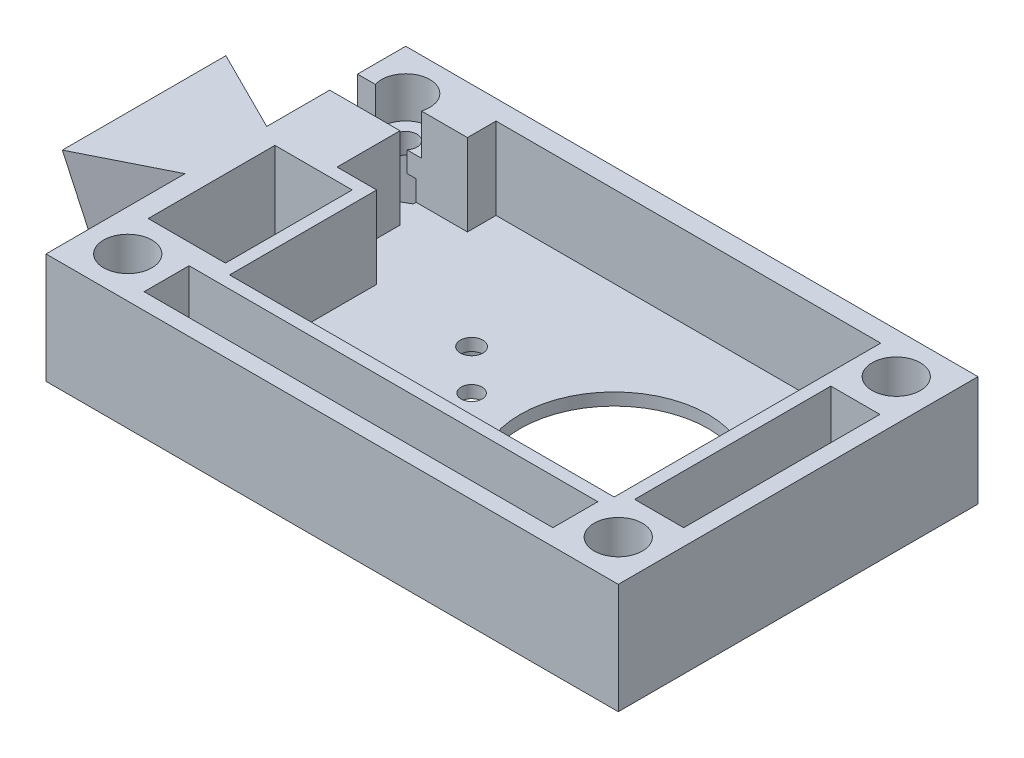
from build123d import *

# Parameters (mm, degrees)
SKETCH3_W           = 381
SKETCH3_H           = 111.76
BOSS_EXTRUDE1_DEPTH = 34.29
SKETCH2_4_R         = 29.21
CUT_EXTRUDE2_DEPTH  = 127
CUT_EXTRUDE3_START  = 8.89
SKETCH2_5_W         = 119.507
SKETCH2_5_H         = 82.804
CUT_EXTRUDE3_DEPTH  = 127
CUT_EXTRUDE4_START  = 8.89
SKETCH2_W           = 6.604
SKETCH2_H           = 8.636
CUT_EXTRUDE4_DEPTH  = 127
CUT_EXTRUDE6_DEPTH  = 127
CUT_EXTRUDE7_DEPTH  = 127
SKETCH7_W           = 19.689939458
SKETCH7_H           = 8.636
CUT_EXTRUDE8_DEPTH  = 25.4
SKETCH8_W           = 102.108
SKETCH8_H           = 102.108
CUT_EXTRUDE9_DEPTH  = 5.08
SKETCH9_R           = 7.5
CUT_EXTRUDE10_DEPTH = 12.7
SKETCH10_R          = 3.5
CUT_EXTRUDE11_DEPTH = 55.372
CUT_EXTRUDE12_DEPTH = 15.24
SKETCH12_R          = 3.25
SKETCH12_R_2        = 3.5
CUT_EXTRUDE13_DEPTH = 12.446
SKETCH13_R          = 7.5
CUT_EXTRUDE14_DEPTH = 5.08
SKETCH14_W          = 127
SKETCH14_H          = 13.97
SKETCH14_W_2        = 24.003
SKETCH14_H_2        = 39.37
SKETCH14_W_3        = 15.24
SKETCH14_H_3        = 60.96
CUT_EXTRUDE15_DEPTH = 25.4


with BuildPart() as part:
    # Sketch3 → Boss-Extrude1 (new body)
    with BuildSketch(Plane(origin=(0, 0, 0), x_dir=(1, 0, 0), z_dir=(0, 1, 0))):
        with Locations((139.7, 36.195)):
            Rectangle(SKETCH3_W, SKETCH3_H)
    extrude(amount=BOSS_EXTRUDE1_DEPTH)

    # Sketch2<4> → Cut-Extrude2 (cut)
    with BuildSketch(Plane(origin=(0, 0, 0), x_dir=(1, 0, 0), z_dir=(0, 1, 0))):
        with Locations(Location((273.05, 36.195, 0), (0, 0, 270))):
            Circle(SKETCH2_4_R)
    extrude(amount=CUT_EXTRUDE2_DEPTH, mode=Mode.SUBTRACT)

    # Sketch2<5> → Cut-Extrude3 (cut)
    with BuildSketch(Plane(origin=(0, 0, 0), x_dir=(1, 0, 0), z_dir=(0, 1, 0)).offset(CUT_EXTRUDE3_START)):
        with Locations((246.3165, 44.577)):
            Rectangle(SKETCH2_5_W, SKETCH2_5_H)
    extrude(amount=CUT_EXTRUDE3_DEPTH, mode=Mode.SUBTRACT)

    # Sketch2 → Cut-Extrude4 (cut)
    with BuildSketch(Plane(origin=(0, 0, 0), x_dir=(1, 0, 0), z_dir=(0, 1, 0)).offset(CUT_EXTRUDE4_START)):
        Polygon((174.244, 48.895), (186.563, 48.895), (186.563, 77.089), (174.244, 77.089), (174.244, 68.453), align=None)
        with Locations((170.942, 72.771)):
            Rectangle(SKETCH2_W, SKETCH2_H)
    extrude(amount=CUT_EXTRUDE4_DEPTH, mode=Mode.SUBTRACT)

    # Sketch4 → Cut-Extrude6 (cut)
    with BuildSketch(Plane(origin=(0, 34.29, 0), x_dir=(1, 0, 0), z_dir=(0, 1, 0))):
        Polygon((152.4, 48.895), (127, 61.595), (127, 10.795), (152.4, 23.495), (152.4, -19.685), (-50.8, -19.685), (-50.8, 92.075), (152.4, 92.075), align=None)
    extrude(amount=-CUT_EXTRUDE6_DEPTH, mode=Mode.SUBTRACT)

    # Sketch6 → Cut-Extrude7 (cut)
    with BuildSketch(Plane.XY.offset(19.685)):
        Polygon((127, 34.29), (136.187977808, 0), (101.054732315, 0), align=None)
    extrude(amount=-CUT_EXTRUDE7_DEPTH, mode=Mode.SUBTRACT)

    # Sketch7 → Cut-Extrude8 (cut)
    with BuildSketch(Plane(origin=(0, 34.29, 0), x_dir=(1, 0, 0), z_dir=(0, 1, 0))):
        with Locations((157.795030271, 72.771)):
            Rectangle(SKETCH7_W, SKETCH7_H)
    extrude(amount=-CUT_EXTRUDE8_DEPTH, mode=Mode.SUBTRACT)

    # Sketch8 → Cut-Extrude9 (cut)
    with BuildSketch(Plane.XZ):
        with Locations((273.05, -36.195)):
            Rectangle(SKETCH8_W, SKETCH8_H)
    extrude(amount=-CUT_EXTRUDE9_DEPTH, mode=Mode.SUBTRACT)

    # Sketch9 → Cut-Extrude10 (cut)
    with BuildSketch(Plane(origin=(0, 34.29, 0), x_dir=(1, 0, 0), z_dir=(0, 1, 0))):
        with Locations(Location((317.5, 79.375, 0), (0, 0, 270))):
            Circle(SKETCH9_R)
        with Locations(Location((317.5, -6.985, 0), (0, 0, 270))):
            Circle(SKETCH9_R)
        with Locations((165.1, 79.375)):
            Circle(SKETCH9_R)
        with Locations(Location((165.1, -6.985, 0), (0, 0, 270))):
            Circle(SKETCH9_R)
    extrude(amount=-CUT_EXTRUDE10_DEPTH, mode=Mode.SUBTRACT)

    # Sketch10 → Cut-Extrude11 (cut)
    with BuildSketch(Plane(origin=(0, 21.59, 0), x_dir=(1, 0, 0), z_dir=(0, 1, 0))):
        with Locations(Location((317.5, 79.375, 0), (0, 0, 270))):
            Circle(SKETCH10_R)
        with Locations(Location((317.5, -6.985, 0), (0, 0, 270))):
            Circle(SKETCH10_R)
        with Locations(Location((165.1, -6.985, 0), (0, 0, 270))):
            Circle(SKETCH10_R)
        with Locations(Location((165.1, 79.375, 0), (0, 0, 270))):
            Circle(SKETCH10_R)
    extrude(amount=-CUT_EXTRUDE11_DEPTH, mode=Mode.SUBTRACT)

    # Sketch11 → Cut-Extrude12 (cut)
    with BuildSketch(Plane.XZ):
        Polygon((159.6, -82.550426481), (165.1, -85.725852961), (170.6, -82.550426481), (170.6, -76.199573519), (165.1, -73.024147039), (159.6, -76.199573519), align=None)
        Polygon((312, 3.809573519), (317.5, 0.634147039), (323, 3.809573519), (323, 10.160426481), (317.5, 13.335852961), (312, 10.160426481), align=None)
        Polygon((165.1, 0.634147039), (170.6, 3.809573519), (170.6, 10.160426481), (165.1, 13.335852961), (159.6, 10.160426481), (159.6, 3.809573519), align=None)
        Polygon((317.5, -85.725852961), (323, -82.550426481), (323, -76.199573519), (317.5, -73.024147039), (312, -76.199573519), (312, -82.550426481), align=None)
    extrude(amount=-CUT_EXTRUDE12_DEPTH, mode=Mode.SUBTRACT)

    # Sketch12 → Cut-Extrude13 (cut)
    with BuildSketch(Plane(origin=(0, 8.89, 0), x_dir=(1, 0, 0), z_dir=(0, 1, 0))):
        with Locations(Location((230.55, 34.395, 0), (0, 0, 270))):
            Circle(SKETCH12_R)
        with Locations(Location((218.05, 46.895, 0), (0, 0, 270))):
            Circle(SKETCH12_R_2)
    extrude(amount=-CUT_EXTRUDE13_DEPTH, mode=Mode.SUBTRACT)

    # Sketch13 → Cut-Extrude14 (cut)
    with BuildSketch(Plane.XZ):
        with Locations((218.05, -46.895)):
            Circle(SKETCH13_R)
    extrude(amount=-CUT_EXTRUDE14_DEPTH, mode=Mode.SUBTRACT)

    # Sketch14 → Cut-Extrude15 (cut)
    with BuildSketch(Plane(origin=(0, 34.29, 0), x_dir=(1, 0, 0), z_dir=(0, 1, 0))):
        with Locations((241.3, -7.62)):
            Rectangle(SKETCH14_W, SKETCH14_H)
        with Locations((170.7515, 25.4)):
            Rectangle(SKETCH14_W_2, SKETCH14_H_2)
        with Locations((317.5, 36.195)):
            Rectangle(SKETCH14_W_3, SKETCH14_H_3)
    extrude(amount=-CUT_EXTRUDE15_DEPTH, mode=Mode.SUBTRACT)


solid = part.part
